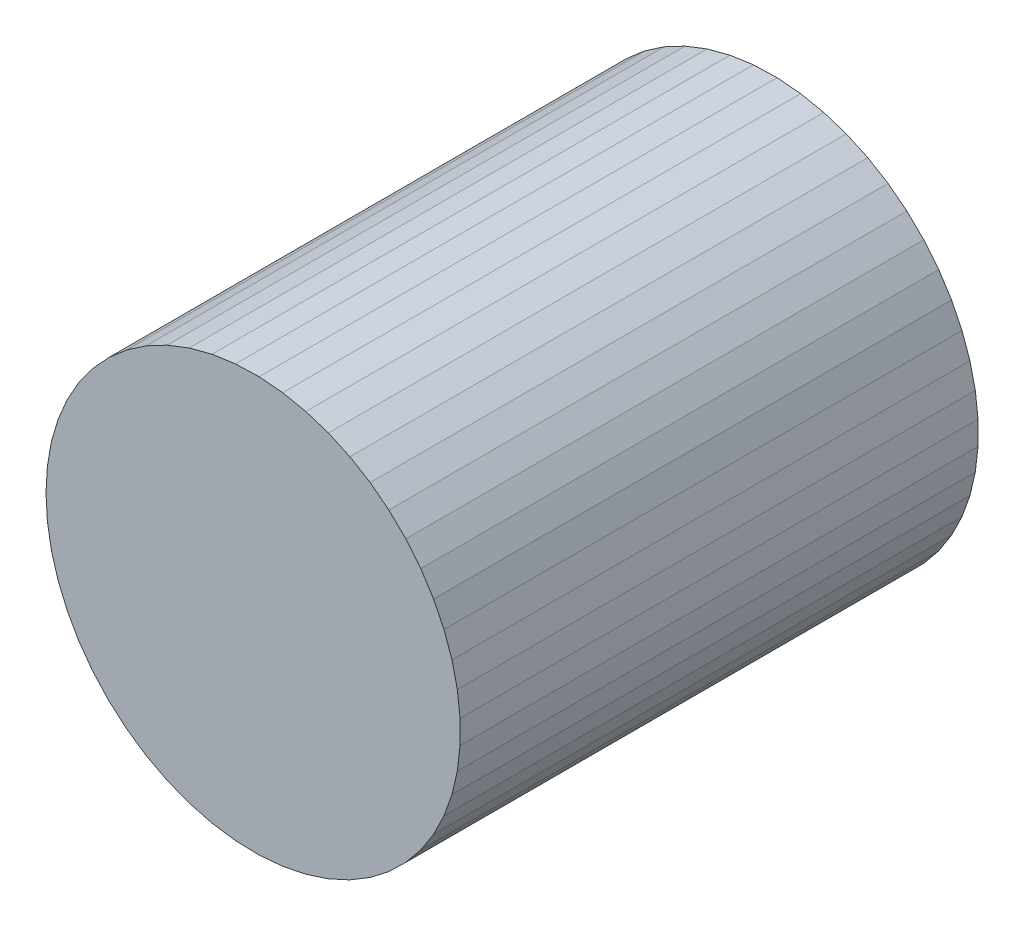
from build123d import *

# Parameters (mm, degrees)
TH_N_NGO_I_DEPTH      = 50
KHOANG_START          = 0.5
KHOANG_R_NG_K_N_DEPTH = 49


with BuildPart() as part:
    # Biên dạng ngoài theo phôi gốc → Thân ngoài (new body)
    with BuildSketch(Plane.XY):
        Polygon((-20, 0), (-19.869634628, -2.279828072), (-19.480237961, -4.52993536), (-18.83688736, -6.720988274), (-17.947967529, -8.824421883), (-16.825069428, -10.81281662), (-15.482831955, -12.66024971), (-13.938751221, -14.342636108), (-12.212957382, -15.83804512), (-10.327949524, -17.126981735), (-8.308300018, -18.192638397), (-6.180339813, -19.021131515), (-3.971809387, -19.601652145), (-1.711500168, -19.926635742), (0.571121037, -19.991844177), (2.846296787, -19.79642868), (5.084366798, -19.34293747), (7.25615406, -18.637279511), (9.333346367, -17.688657761), (11.288864136, -16.509437561), (13.097214699, -15.114992142), (14.734822273, -13.523497581), (16.180339813, -11.75570488), (17.414920807, -9.834658623), (18.422472, -7.785401821), (19.18985939, -5.634651184), (19.707077026, -3.410444021), (19.967382431, -1.141776204), (19.967382431, 1.141776204), (19.707077026, 3.410444021), (19.18985939, 5.634651184), (18.422472, 7.785401821), (17.414920807, 9.834658623), (16.180339813, 11.75570488), (14.734822273, 13.523497581), (13.097214699, 15.114992142), (11.288864136, 16.509437561), (9.333346367, 17.688657761), (7.25615406, 18.637279511), (5.084366798, 19.34293747), (2.846296787, 19.79642868), (0.571121037, 19.991844177), (-1.711500168, 19.926635742), (-3.971809387, 19.601652145), (-6.180339813, 19.021131515), (-8.308300018, 18.192638397), (-10.327949524, 17.126981735), (-12.212957382, 15.83804512), (-13.938751221, 14.342636108), (-15.482831955, 12.66024971), (-16.825069428, 10.81281662), (-17.947967529, 8.824421883), (-18.83688736, 6.720988274), (-19.480237961, 4.52993536), (-19.869634628, 2.279828072), align=None)
    extrude(amount=TH_N_NGO_I_DEPTH)

    # Biên dạng trong cách thành ngoài 0,3 mm → Khoang rỗng kín (cut)
    with BuildSketch(Plane.XY.offset(KHOANG_START)):
        Polygon((-19.57110405, -2.245574713), (-19.187557221, -4.461875439), (-18.553873062, -6.620008946), (-17.678308487, -8.691839218), (-16.572280884, -10.650359154), (-15.250209808, -12.470035553), (-13.729328155, -14.127144813), (-12.029463768, -15.600086212), (-10.172777176, -16.869657516), (-8.18347168, -17.919303894), (-6.087482929, -18.735347748), (-3.912134886, -19.30714798), (-1.68578577, -19.627248764), (0.562540114, -19.691476822), (2.8035326, -19.498996735), (5.007976532, -19.052318573), (7.147133827, -18.357263565), (9.193117142, -17.422893524), (11.119255066, -16.261390686), (12.900435448, -14.887896538), (14.513439179, -13.320313454), (15.937238693, -11.579081535), (17.153270721, -9.686898232), (18.145683289, -7.668429852), (18.901540756, -5.549993038), (19.410987854, -3.359203815), (19.667383194, -1.12462163), (19.667383194, 1.12462163), (19.410987854, 3.359203815), (18.901540756, 5.549993038), (18.145683289, 7.668429852), (17.153270721, 9.686898232), (15.937238693, 11.579081535), (14.513439179, 13.320313454), (12.900435448, 14.887896538), (11.119255066, 16.261390686), (9.193117142, 17.422893524), (7.147133827, 18.357263565), (5.007976532, 19.052318573), (2.8035326, 19.498996735), (0.562540114, 19.691476822), (-1.68578577, 19.627248764), (-3.912134886, 19.30714798), (-6.087482929, 18.735347748), (-8.18347168, 17.919303894), (-10.172777176, 16.869657516), (-12.029463768, 15.600086212), (-13.729328155, 14.127144813), (-15.250209808, 12.470035553), (-16.572280884, 10.650359154), (-17.678308487, 8.691839218), (-18.553873062, 6.620008946), (-19.187557221, 4.461875439), (-19.57110405, 2.245574713), (-19.699510574, 0), align=None)
    extrude(amount=KHOANG_R_NG_K_N_DEPTH, mode=Mode.SUBTRACT)


solid = part.part
